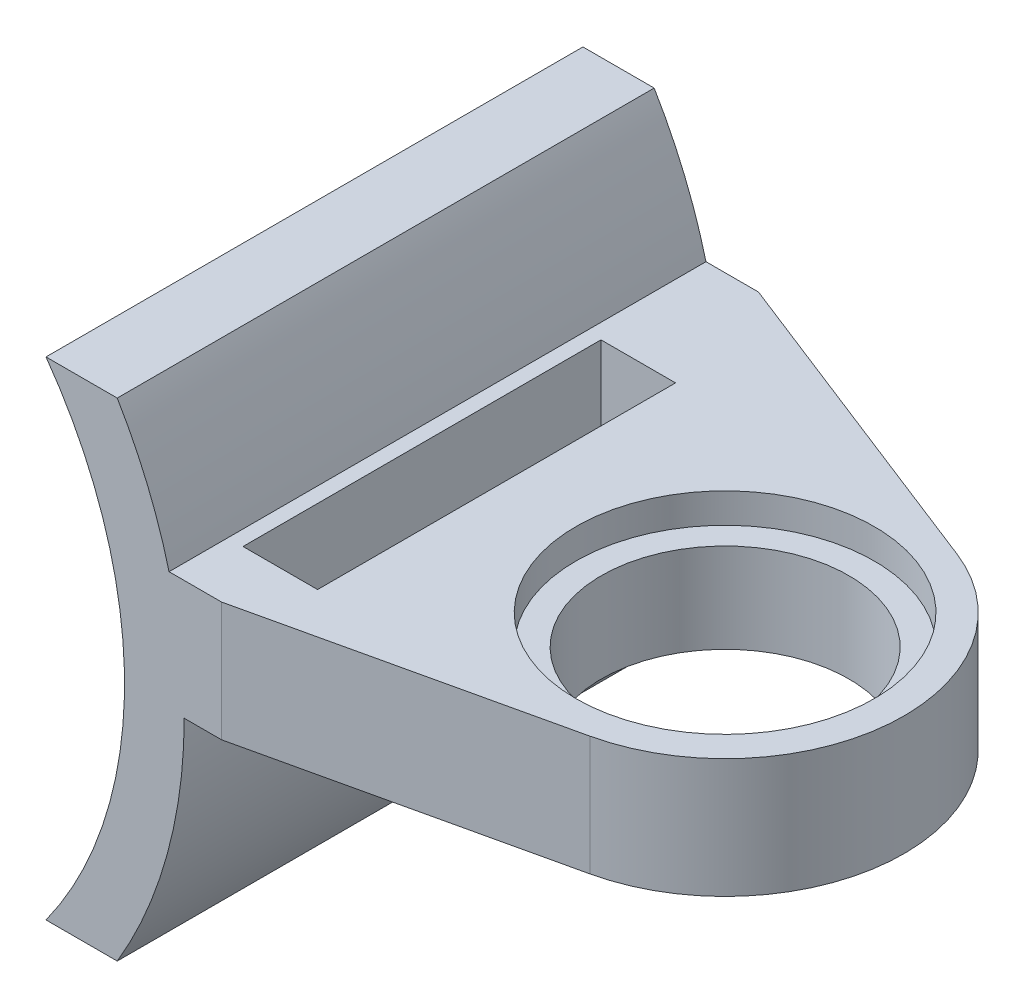
from build123d import *

# Parameters (mm, degrees)
EXTRUDE_1_DEPTH     = 18
SKETCH_3_R          = 4.15
SKETCH_3_W          = 2.5
SKETCH_3_H          = 12
EXTRUDE_2_DEPTH     = 4
SKETCH_4_R          = 5
CUT_EXTRUDE_1_DEPTH = 1


with BuildPart() as part:
    # 草图1 → 凸台-拉伸1 (new body)
    with BuildSketch(Plane.XY):
        with BuildLine():
            Line((13.754950724, 8.173208097), (11.36655926, 8.173208097))
            ThreePointArc((11.36655926, 8.173208097), (14, 0), (11.36655926, -8.173208097))
            Line((11.36655926, -8.173208097), (13.754950724, -8.173208097))
            ThreePointArc((13.754950724, -8.173208097), (16, 0), (13.754950724, 8.173208097))
        make_face()
    extrude(amount=EXTRUDE_1_DEPTH)

    # 草图3 → 凸台-拉伸2 (add)
    with BuildSketch(Plane(origin=(0, 0, 0), x_dir=(1, 0, 0), z_dir=(0, 1, 0))):
        with BuildLine():
            Line((17.25, -18), (14.877475362, -18))
            Line((14.877475362, -18), (14.877475362, 0))
            Line((14.877475362, 0), (17.25, 0))
            Line((17.25, 0), (28.186274783, -4.279138082))
            ThreePointArc((28.186274783, -4.279138082), (31.98307184, -10.317032459), (27.325150791, -15.718477442))
            Line((27.325150791, -15.718477442), (17.25, -18))
        make_face()
        with Locations(Location((26, -9.866642228, 0), (0, 0, 270))):
            Circle(SKETCH_3_R, mode=Mode.SUBTRACT)
        with Locations((17.25, -10.028578804)):
            Rectangle(SKETCH_3_W, SKETCH_3_H, mode=Mode.SUBTRACT)
    extrude(amount=EXTRUDE_2_DEPTH)

    # 草图4 → 切除-拉伸1 (cut)
    with BuildSketch(Plane(origin=(0, 4, 0), x_dir=(1, 0, 0), z_dir=(0, 1, 0))):
        with Locations(Location((26, -9.866642228, 0), (0, 0, 270))):
            Circle(SKETCH_4_R)
    extrude(amount=-CUT_EXTRUDE_1_DEPTH, mode=Mode.SUBTRACT)


solid = part.part
